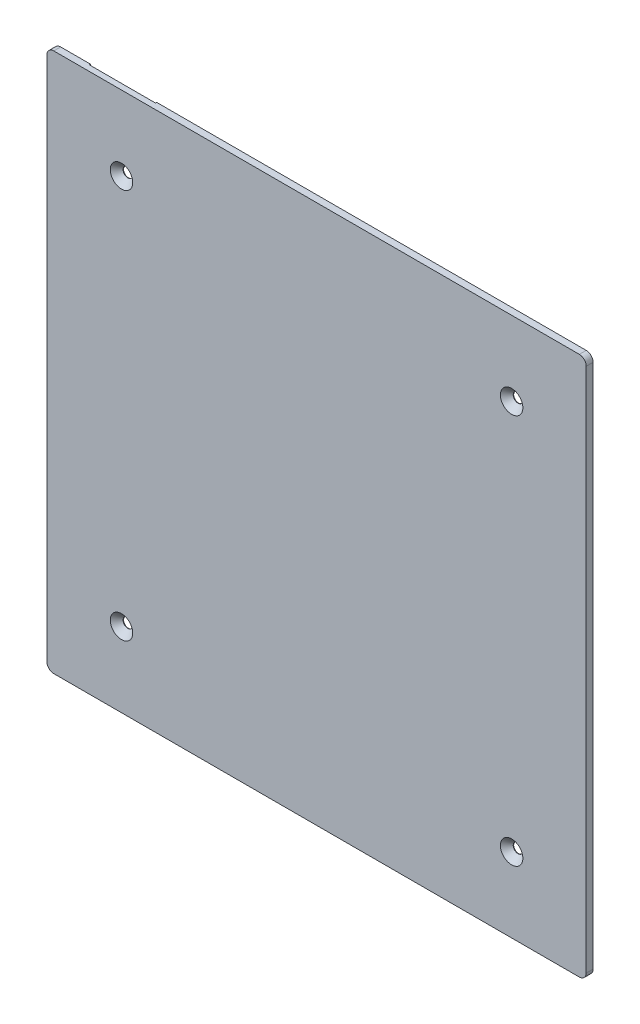
from build123d import *

# Parameters (mm, degrees)
CROQUIS1_W                                  = 235
CROQUIS1_H                                  = 235
SALIENTE_EXTRUIR1_DEPTH                     = 3
CROQUIS2_W                                  = 28.812164255
CROQUIS2_H                                  = 11.449209801
CORTAR_EXTRUIR1_DEPTH                       = 0.5
AVELLANADO_PARA_TORNILLO_CON_CABEZA_2_COUNT = 2
AVELLANADO_PARA_TORNILLO_CON_CABEZA_2_PITCH = 170
AVELLANADO_PARA_TORNILLO_CON_CABEZA_3_COUNT = 2
AVELLANADO_PARA_TORNILLO_CON_CABEZA_3_PITCH = 240.416305603
AVELLANADO_PARA_TORNILLO_CON_CABEZA_4_COUNT = 2
AVELLANADO_PARA_TORNILLO_CON_CABEZA_4_PITCH = 170
REDONDEO1_R                                 = 3


with BuildPart() as part:
    # Croquis1 → Saliente-Extruir1 (new body)
    with BuildSketch(Plane(origin=(0, 0, 0), x_dir=(-1, 0, 0), z_dir=(0, 0, -1))):
        Rectangle(CROQUIS1_W, CROQUIS1_H)
    extrude(amount=-SALIENTE_EXTRUIR1_DEPTH)

    # Croquis2 → Cortar-Extruir1 (cut)
    with BuildSketch(Plane(origin=(0, 0, 0), x_dir=(-1, 0, 0), z_dir=(0, 0, -1))):
        with Locations((87.056843615, 111.7753951)):
            Rectangle(CROQUIS2_W, CROQUIS2_H)
    extrude(amount=-CORTAR_EXTRUIR1_DEPTH, mode=Mode.SUBTRACT)

    # Croquis3 → Avellanado para tornillo con cabeza plana de M3.51 (revolve, cut)
    with BuildSketch(Plane(origin=(-85, -85, 3), x_dir=(0, -1, 0), z_dir=(1, 0, 0))):
        Polygon((0, 0), (0, 3), (2.1, 3), (2.1, 2.8), (4.9, 0), align=None)
    avellanado_para_tornillo_con_cabeza_plan = revolve(axis=Axis((-85, -85, 9.35), (0, 0, -1)), mode=Mode.SUBTRACT)

    # Avellanado para tornillo con cabeza  2: Avellanado para tornillo con cabeza plana de M3.51 ×2
    with Locations(*[(i * AVELLANADO_PARA_TORNILLO_CON_CABEZA_2_PITCH, 0, 0) for i in range(1, AVELLANADO_PARA_TORNILLO_CON_CABEZA_2_COUNT)]):
        add(avellanado_para_tornillo_con_cabeza_plan, mode=Mode.SUBTRACT)

    # Avellanado para tornillo con cabeza  3: Avellanado para tornillo con cabeza plana de M3.51 ×2
    with Locations(*[Vector(0.7071067811865476, 0.7071067811865476, 0) * (i * AVELLANADO_PARA_TORNILLO_CON_CABEZA_3_PITCH) for i in range(1, AVELLANADO_PARA_TORNILLO_CON_CABEZA_3_COUNT)]):
        add(avellanado_para_tornillo_con_cabeza_plan, mode=Mode.SUBTRACT)

    # Avellanado para tornillo con cabeza  4: Avellanado para tornillo con cabeza plana de M3.51 ×2
    with Locations(*[(0, i * AVELLANADO_PARA_TORNILLO_CON_CABEZA_4_PITCH, 0) for i in range(1, AVELLANADO_PARA_TORNILLO_CON_CABEZA_4_COUNT)]):
        add(avellanado_para_tornillo_con_cabeza_plan, mode=Mode.SUBTRACT)

    # Redondeo1
    redondeo1_edges = [part.edges().sort_by_distance(p)[0] for p in [
        (117.5, -117.5, 1.5),
        (117.5, 117.5, 1.5),
        (-117.5, 117.5, 1.5),
        (-117.5, -117.5, 1.5),
    ]]
    fillet(redondeo1_edges, radius=REDONDEO1_R)


solid = part.part
